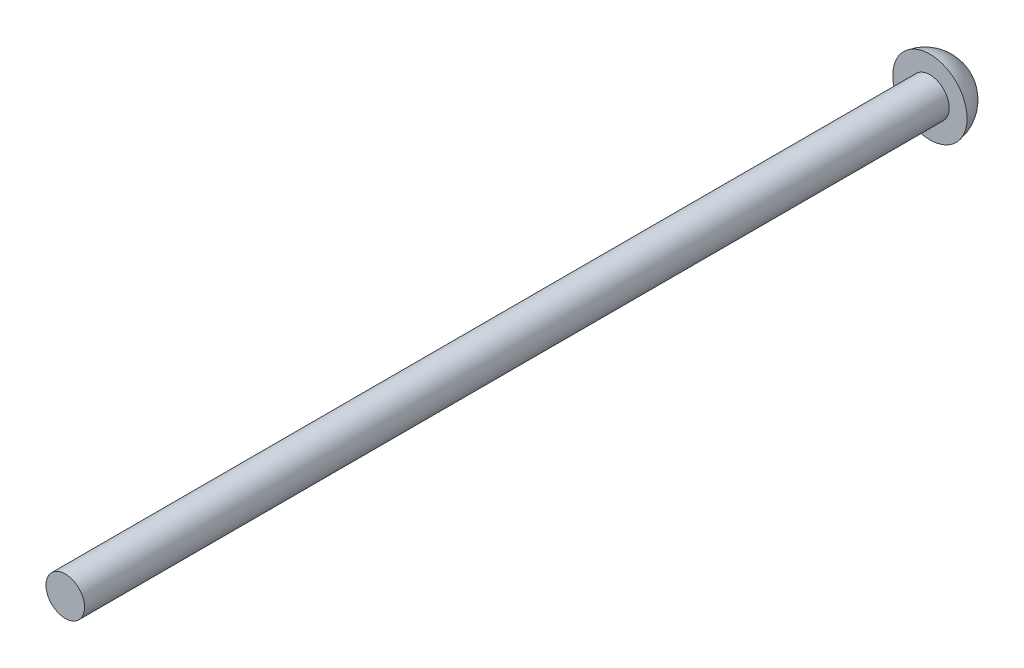
from build123d import *


with BuildPart() as part:
    # Sketch1 → Revolve1 (revolve)
    with BuildSketch(Plane(origin=(0, 0, 0), x_dir=(1, 0, 0), z_dir=(0, 1, 0))):
        with BuildLine():
            Line((0, 0), (0, 79.07))
            ThreePointArc((0, 79.07), (2.177299072, 78.250972809), (3.275, 76.2))
            Line((3.275, 76.2), (1.7, 76.2))
            Line((1.7, 76.2), (1.7, 0))
            Line((1.7, 0), (0, 0))
        make_face()
    revolve(axis=Axis((0, 0, 0), (0, 0, -1)))


solid = part.part
